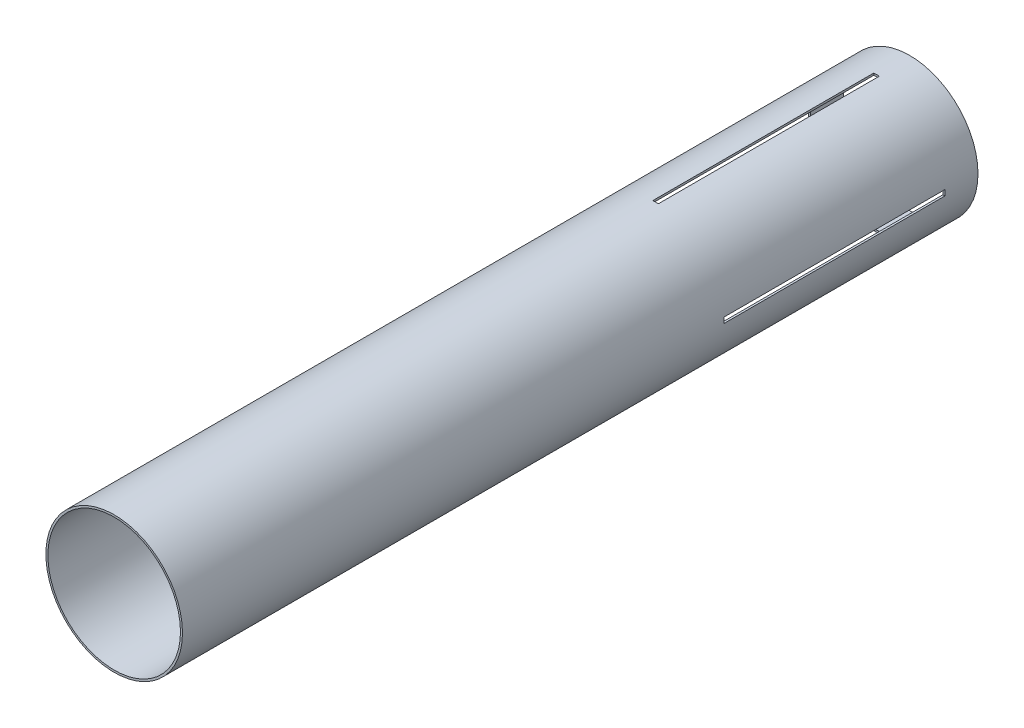
from build123d import *

# Parameters (mm, degrees)
SKETCH1_R           = 39.2557
SKETCH1_R_2         = 38.1
BOSS_EXTRUDE1_DEPTH = 228.6
SKETCH3_W           = 3.175
SKETCH3_H           = 127
CUT_EXTRUDE1_DEPTH  = 236.24451102
CIRPATTERN1_COUNT   = 4


with BuildPart() as part:
    # Sketch1 → Boss-Extrude1 (new, symmetric)
    with BuildSketch(Plane.XY):
        Circle(SKETCH1_R)
        Circle(SKETCH1_R_2, mode=Mode.SUBTRACT)
    extrude(amount=BOSS_EXTRUDE1_DEPTH, both=True)

    # Sketch3 → Cut-Extrude1 (cut, through all)
    with BuildSketch(Plane(origin=(0, 0, 0), x_dir=(1, 0, 0), z_dir=(0, 1, 0))):
        with Locations((0, 146.05)):
            Rectangle(SKETCH3_W, SKETCH3_H)
    cut_extrude1 = extrude(amount=CUT_EXTRUDE1_DEPTH, mode=Mode.SUBTRACT)

    # CirPattern1: Cut-Extrude1 ×4 about axis
    cirpattern1_axis = Axis((0, 0, 0), (0, 0, 1))
    for i in range(1, CIRPATTERN1_COUNT):
        add(cut_extrude1.rotate(cirpattern1_axis, i * 360 / CIRPATTERN1_COUNT), mode=Mode.SUBTRACT)


solid = part.part
